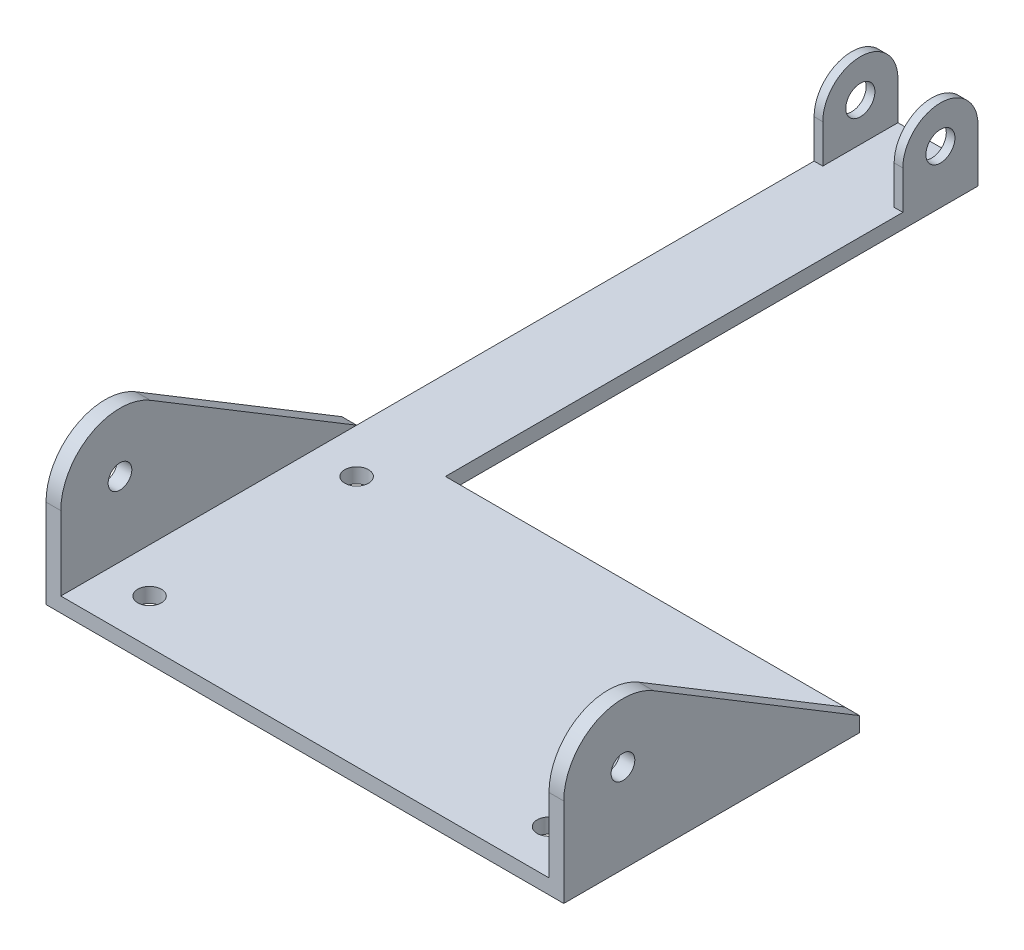
from build123d import *

# Parameters (mm, degrees)
BOSS_EXTRUDE1_DEPTH = 100
SKETCH2_R           = 4
CUT_EXTRUDE1_DEPTH  = 208.665596573
SKETCH3_R           = 4
CUT_EXTRUDE2_DEPTH  = 207.518764281
SKETCH4_W           = 30
SKETCH4_H           = 180
BOSS_EXTRUDE2_DEPTH = 5
SKETCH5_R           = 4.915
BOSS_EXTRUDE3_DEPTH = 30
SKETCH6_W           = 24.13
SKETCH6_H           = 109.462544294
CUT_EXTRUDE3_DEPTH  = 256.049014897


with BuildPart() as part:
    # Sketch1 → Boss-Extrude1 (new body)
    with BuildSketch(Plane.XY):
        Polygon((0, 50), (5, 50), (5, 5), (170, 5), (170, 50), (175, 50), (175, 0), (0, 0), align=None)
    extrude(amount=BOSS_EXTRUDE1_DEPTH)

    # Sketch2 → Cut-Extrude1 (cut, through all)
    with BuildSketch(Plane.ZY):
        with Locations((80, 30)):
            Circle(SKETCH2_R)
        with BuildLine():
            Line((100, 30), (100, 5))
            Line((100, 5), (131.663980624, 33.697237635))
            Line((131.663980624, 33.697237635), (100, 64.741873333))
            Line((100, 64.741873333), (-14.790865649, 55.926144723))
            Line((-14.790865649, 55.926144723), (0, 5))
            Line((0, 5), (69.651665268, 47.114671141))
            ThreePointArc((69.651665268, 47.114671141), (89.824288915, 47.420773442), (100, 30))
        make_face()
    extrude(amount=-CUT_EXTRUDE1_DEPTH, mode=Mode.SUBTRACT)

    # Sketch3 → Cut-Extrude2 (cut, through all)
    with BuildSketch(Plane(origin=(0, 5, 0), x_dir=(1, 0, 0), z_dir=(0, 1, 0))):
        with Locations(Location((20, -15, 0), (0, 0, 270))):
            Circle(SKETCH3_R)
        with Locations(Location((155, -15, 0), (0, 0, 270))):
            Circle(SKETCH3_R)
        with Locations(Location((155, -85, 0), (0, 0, 270))):
            Circle(SKETCH3_R)
        with Locations(Location((20, -85, 0), (0, 0, 270))):
            Circle(SKETCH3_R)
    extrude(amount=-CUT_EXTRUDE2_DEPTH, mode=Mode.SUBTRACT)

    # Sketch4 → Boss-Extrude2 (add)
    with BuildSketch(Plane(origin=(0, 5, 0), x_dir=(1, 0, 0), z_dir=(0, 1, 0))):
        with Locations((20, 90)):
            Rectangle(SKETCH4_W, SKETCH4_H)
    extrude(amount=-BOSS_EXTRUDE2_DEPTH)

    # Sketch5 → Boss-Extrude3 (add)
    with BuildSketch(Plane.ZY.offset(-5)):
        with BuildLine():
            Line((-180, 18), (-180, 5))
            Line((-180, 5), (-154.6, 5))
            Line((-154.6, 5), (-154.6, 18))
            ThreePointArc((-154.6, 18), (-167.3, 30.7), (-180, 18))
        make_face()
        with Locations((-167.3, 18)):
            Circle(SKETCH5_R, mode=Mode.SUBTRACT)
    extrude(amount=-BOSS_EXTRUDE3_DEPTH)

    # Sketch6 → Cut-Extrude3 (cut, through all)
    with BuildSketch(Plane(origin=(0, 5, 0), x_dir=(1, 0, 0), z_dir=(0, 1, 0))):
        with Locations((20, 162.88766727)):
            Rectangle(SKETCH6_W, SKETCH6_H)
    extrude(amount=CUT_EXTRUDE3_DEPTH, mode=Mode.SUBTRACT)


solid = part.part
